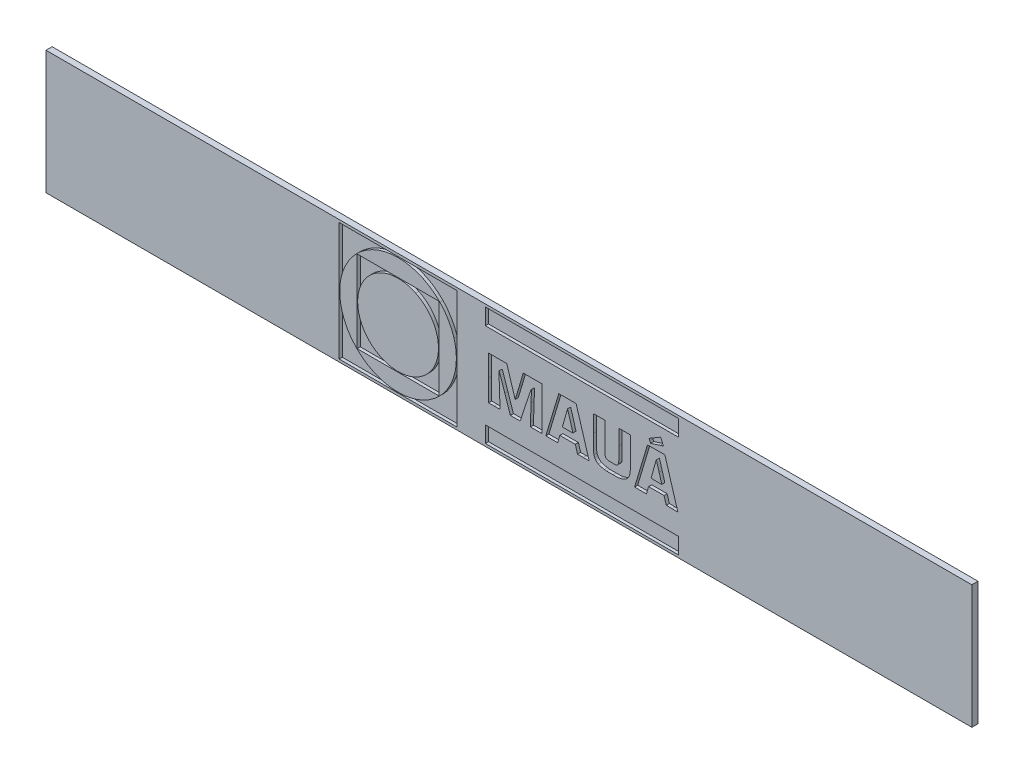
from build123d import *

# Parameters (mm, degrees)
SKETCH2_W           = 150
SKETCH2_H           = 20
BOSS_EXTRUDE1_DEPTH = 1
CUT_EXTRUDE2_DEPTH  = 0.5


with BuildPart() as part:
    # Sketch2 → Boss-Extrude1 (new body)
    with BuildSketch(Plane.XY):
        Rectangle(SKETCH2_W, SKETCH2_H)
    extrude(amount=-BOSS_EXTRUDE1_DEPTH)

    # Model → Cut-Extrude2 (cut)
    # profile 1 of 9: a face of its own
    with BuildSketch(Plane.XY):
        Polygon((-27.499542, 8.9e-05), (-27.499542, 9.575424), (-17.939724, 9.575424), (-8.379913, 9.575424), (-8.379913, 8.9e-05), (-8.379913, -9.575246), (-17.939724, -9.575246), (-27.499542, -9.575246), align=None)
        with BuildLine():
            add(Edge.make_bspline(
                [(-17.066178, -9.419263), (-15.21787, -9.236705), (-13.518165, -8.544789), (-12.053683, -7.37885)],
                knots=[0, 0, 0, 0, 1, 1, 1, 1], degree=3))
            add(Edge.make_bspline(
                [(-12.053683, -7.37885), (-11.634327, -7.044982), (-10.925684, -6.338994), (-10.598194, -5.928821)],
                knots=[0, 0, 0, 0, 1, 1, 1, 1], degree=3))
            add(Edge.make_bspline(
                [(-10.598194, -5.928821), (-8.649083, -3.487571), (-8.024915, -0.334739), (-8.896724, 2.665723)],
                knots=[0, 0, 0, 0, 1, 1, 1, 1], degree=3))
            add(Edge.make_bspline(
                [(-8.896724, 2.665723), (-9.302419, 4.061981), (-10.126115, 5.46327), (-11.183323, 6.555724)],
                knots=[0, 0, 0, 0, 1, 1, 1, 1], degree=3))
            add(Edge.make_bspline(
                [(-11.183323, 6.555724), (-12.735721, 8.159872), (-14.75563, 9.143306), (-17.008575, 9.391853)],
                knots=[0, 0, 0, 0, 1, 1, 1, 1], degree=3))
            add(Edge.make_bspline(
                [(-17.008575, 9.391853), (-17.487, 9.444634), (-18.526898, 9.435902), (-19.041588, 9.374815)],
                knots=[0, 0, 0, 0, 1, 1, 1, 1], degree=3))
            add(Edge.make_bspline(
                [(-19.041588, 9.374815), (-21.903657, 9.034957), (-24.437051, 7.425753), (-25.982041, 4.966257)],
                knots=[0, 0, 0, 0, 1, 1, 1, 1], degree=3))
            add(Edge.make_bspline(
                [(-25.982041, 4.966257), (-26.536223, 4.084045), (-26.963523, 3.046296), (-27.189766, 2.03313)],
                knots=[0, 0, 0, 0, 1, 1, 1, 1], degree=3))
            add(Edge.make_bspline(
                [(-27.189766, 2.03313), (-27.441569, 0.905518), (-27.474466, -0.450455), (-27.277869, -1.598358)],
                knots=[0, 0, 0, 0, 1, 1, 1, 1], degree=3))
            add(Edge.make_bspline(
                [(-27.277869, -1.598358), (-27.010868, -3.157349), (-26.350419, -4.628282), (-25.350524, -5.890896)],
                knots=[0, 0, 0, 0, 1, 1, 1, 1], degree=3))
            add(Edge.make_bspline(
                [(-25.350524, -5.890896), (-25.036828, -6.287019), (-24.257652, -7.068349), (-23.868054, -7.377473)],
                knots=[0, 0, 0, 0, 1, 1, 1, 1], degree=3))
            add(Edge.make_bspline(
                [(-23.868054, -7.377473), (-22.462892, -8.492383), (-20.802418, -9.194848), (-19.119187, -9.386483)],
                knots=[0, 0, 0, 0, 1, 1, 1, 1], degree=3))
            add(Edge.make_bspline(
                [(-19.119187, -9.386483), (-18.957006, -9.404964), (-18.782415, -9.424934), (-18.731202, -9.430909)],
                knots=[0, 0, 0, 0, 1, 1, 1, 1], degree=3))
            add(Edge.make_bspline(
                [(-18.731202, -9.430909), (-18.51204, -9.456459), (-17.361013, -9.448429), (-17.066178, -9.419263)],
                knots=[0, 0, 0, 0, 1, 1, 1, 1], degree=3))
        make_face(mode=Mode.SUBTRACT)
    # profile 2 of 9: a face of its own
    with BuildSketch(Plane.XY):
        Polygon((-24.581933, -0.015428), (-24.581933, 6.626778), (-17.955246, 6.626778), (-11.328556, 6.626778), (-11.328556, -0.015428), (-11.328556, -6.657639), (-17.955246, -6.657639), (-24.581933, -6.657639), align=None)
        with BuildLine():
            add(Edge.make_bspline(
                [(-17.314103, -6.532183), (-14.324241, -6.231309), (-11.884072, -3.887246), (-11.469903, -0.917792)],
                knots=[0, 0, 0, 0, 1, 1, 1, 1], degree=3))
            add(Edge.make_bspline(
                [(-11.469903, -0.917792), (-11.408064, -0.474448), (-11.407226, 0.449162), (-11.467878, 0.878586)],
                knots=[0, 0, 0, 0, 1, 1, 1, 1], degree=3))
            add(Edge.make_bspline(
                [(-11.467878, 0.878586), (-11.776606, 3.050471), (-13.125663, 4.904167), (-15.099326, 5.868433)],
                knots=[0, 0, 0, 0, 1, 1, 1, 1], degree=3))
            add(Edge.make_bspline(
                [(-15.099326, 5.868433), (-16.43455, 6.520774), (-17.917136, 6.697104), (-19.382618, 6.377867)],
                knots=[0, 0, 0, 0, 1, 1, 1, 1], degree=3))
            add(Edge.make_bspline(
                [(-19.382618, 6.377867), (-20.325978, 6.172369), (-21.378243, 5.655664), (-22.126394, 5.030567)],
                knots=[0, 0, 0, 0, 1, 1, 1, 1], degree=3))
            add(Edge.make_bspline(
                [(-22.126394, 5.030567), (-25.070257, 2.570896), (-25.320009, -1.791236), (-22.674552, -4.543472)],
                knots=[0, 0, 0, 0, 1, 1, 1, 1], degree=3))
            add(Edge.make_bspline(
                [(-22.674552, -4.543472), (-21.281862, -5.992374), (-19.29075, -6.731069), (-17.314103, -6.532183)],
                knots=[0, 0, 0, 0, 1, 1, 1, 1], degree=3))
        make_face(mode=Mode.SUBTRACT)
    # profile 3 of 9: a face of its own
    with BuildSketch(Plane.XY):
        Polygon((-3.817273, -8.271636), (-3.817273, -6.968026), (11.841581, -6.968026), (27.500432, -6.968026), (27.500432, -8.271636), (27.500432, -9.575246), (11.841581, -9.575246), (-3.817273, -9.575246), align=None)
    # profile 4 of 9: a face of its own
    with BuildSketch(Plane.XY):
        with BuildLine():
            Line((13.695633, 0.628616), (13.685557, 3.367751))
            Line((13.685557, 3.367751), (14.618119, 3.367751))
            Line((14.618119, 3.367751), (15.550683, 3.367751))
            Line((15.550683, 3.367751), (15.550683, 0.935874))
            add(Edge.make_bspline(
                [(15.550683, 0.935874), (15.550683, -0.818759), (15.560658, -1.525387), (15.586464, -1.601513)],
                knots=[0, 0, 0, 0, 1, 1, 1, 1], degree=3))
            add(Edge.make_bspline(
                [(15.586464, -1.601513), (15.644171, -1.771658), (15.727573, -1.86762), (15.884556, -1.9445)],
                knots=[0, 0, 0, 0, 1, 1, 1, 1], degree=3))
            add(Edge.make_bspline(
                [(15.884556, -1.9445), (16.019782, -2.010722), (16.080128, -2.017519), (16.625732, -2.027983)],
                knots=[0, 0, 0, 0, 1, 1, 1, 1], degree=3))
            add(Edge.make_bspline(
                [(16.625732, -2.027983), (17.10394, -2.037173), (17.253004, -2.030008), (17.390634, -1.989686)],
                knots=[0, 0, 0, 0, 1, 1, 1, 1], degree=3))
            add(Edge.make_bspline(
                [(17.390634, -1.989686), (17.588102, -1.932282), (17.732216, -1.791919), (17.783572, -1.606996)],
                knots=[0, 0, 0, 0, 1, 1, 1, 1], degree=3))
            add(Edge.make_bspline(
                [(17.783572, -1.606996), (17.805015, -1.529805), (17.8162, -0.660029), (17.816312, 0.939)],
                knots=[0, 0, 0, 0, 1, 1, 1, 1], degree=3))
            Line((17.816312, 0.939), (17.816411, 3.367751))
            Line((17.816411, 3.367751), (18.74756, 3.367751))
            Line((18.74756, 3.367751), (19.678709, 3.367751))
            Line((19.678709, 3.367751), (19.678709, 0.826671))
            add(Edge.make_bspline(
                [(19.678709, 0.826671), (19.678709, -1.294309), (19.671013, -1.75861), (19.632085, -1.981767)],
                knots=[0, 0, 0, 0, 1, 1, 1, 1], degree=3))
            add(Edge.make_bspline(
                [(19.632085, -1.981767), (19.474256, -2.886852), (19.014133, -3.344095), (18.048684, -3.555269)],
                knots=[0, 0, 0, 0, 1, 1, 1, 1], degree=3))
            add(Edge.make_bspline(
                [(18.048684, -3.555269), (17.776709, -3.614761), (17.626847, -3.624189), (16.823184, -3.632402)],
                knots=[0, 0, 0, 0, 1, 1, 1, 1], degree=3))
            add(Edge.make_bspline(
                [(16.823184, -3.632402), (16.319583, -3.637541), (15.872632, -3.636073), (15.829955, -3.628706)],
                knots=[0, 0, 0, 0, 1, 1, 1, 1], degree=3))
            add(Edge.make_bspline(
                [(15.829955, -3.628706), (15.787331, -3.621814), (15.626708, -3.600455), (15.473069, -3.581396)],
                knots=[0, 0, 0, 0, 1, 1, 1, 1], degree=3))
            add(Edge.make_bspline(
                [(15.473069, -3.581396), (15.128168, -3.53861), (14.738772, -3.428372), (14.491309, -3.303451)],
                knots=[0, 0, 0, 0, 1, 1, 1, 1], degree=3))
            add(Edge.make_bspline(
                [(14.491309, -3.303451), (14.120422, -3.116229), (13.91, -2.837476), (13.773881, -2.35305)],
                knots=[0, 0, 0, 0, 1, 1, 1, 1], degree=3))
            add(Edge.make_bspline(
                [(13.773881, -2.35305), (13.706436, -2.113028), (13.705623, -2.082151), (13.695633, 0.628616)],
                knots=[0, 0, 0, 0, 1, 1, 1, 1], degree=3))
        make_face()
    # profile 5 of 9: a face of its own
    with BuildSketch(Plane.XY):
        with BuildLine():
            Line((-3.289624, -0.124066), (-3.289624, 3.367751))
            Line((-3.289624, 3.367751), (-1.816764, 3.367751))
            Line((-1.816764, 3.367751), (-0.343909, 3.367751))
            Line((-0.343909, 3.367751), (-0.281235, 3.158245))
            add(Edge.make_bspline(
                [(-0.281235, 3.158245), (0.495493, 0.561812), (0.982289, -1.008657), (1.010378, -1.008657)],
                knots=[0, 0, 0, 0, 1, 1, 1, 1], degree=3))
            add(Edge.make_bspline(
                [(1.010378, -1.008657), (1.030252, -1.008657), (1.320797, -0.057069), (1.678494, 1.179547)],
                knots=[0, 0, 0, 0, 1, 1, 1, 1], degree=3))
            Line((1.678494, 1.179547), (2.311451, 3.367751))
            Line((2.311451, 3.367751), (3.82538, 3.367751))
            Line((3.82538, 3.367751), (5.339309, 3.367751))
            Line((5.339309, 3.367751), (5.331435, -0.116306))
            Line((5.331435, -0.116306), (5.323562, -3.600358))
            Line((5.323562, -3.600358), (4.397585, -3.608561))
            Line((4.397585, -3.608561), (3.471606, -3.616764))
            Line((3.471606, -3.616764), (3.495682, -2.848099))
            add(Edge.make_bspline(
                [(3.495682, -2.848099), (3.508948, -2.42533), (3.550303, -1.227429), (3.587603, -0.18609)],
                knots=[0, 0, 0, 0, 1, 1, 1, 1], degree=3))
            add(Edge.make_bspline(
                [(3.587603, -0.18609), (3.624895, 0.855246), (3.65246, 1.710738), (3.648852, 1.715009)],
                knots=[0, 0, 0, 0, 1, 1, 1, 1], degree=3))
            add(Edge.make_bspline(
                [(3.648852, 1.715009), (3.607143, 1.76435), (3.460626, 1.35287), (2.701159, -0.946529)],
                knots=[0, 0, 0, 0, 1, 1, 1, 1], degree=3))
            Line((2.701159, -0.946529), (1.819519, -3.615832))
            Line((1.819519, -3.615832), (1.026383, -3.615326))
            Line((1.026383, -3.615326), (0.23325, -3.614819))
            Line((0.23325, -3.614819), (-0.662845, -0.945853))
            add(Edge.make_bspline(
                [(-0.662845, -0.945853), (-1.155707, 0.522075), (-1.572113, 1.723108), (-1.588207, 1.723108)],
                knots=[0, 0, 0, 0, 1, 1, 1, 1], degree=3))
            add(Edge.make_bspline(
                [(-1.588207, 1.723108), (-1.619552, 1.723108), (-1.615334, 1.560543), (-1.501107, -1.644028)],
                knots=[0, 0, 0, 0, 1, 1, 1, 1], degree=3))
            add(Edge.make_bspline(
                [(-1.501107, -1.644028), (-1.462792, -2.71922), (-1.435161, -3.602644), (-1.439718, -3.607204)],
                knots=[0, 0, 0, 0, 1, 1, 1, 1], degree=3))
            add(Edge.make_bspline(
                [(-1.439718, -3.607204), (-1.44425, -3.611736), (-1.862357, -3.615483), (-2.368801, -3.615483)],
                knots=[0, 0, 0, 0, 1, 1, 1, 1], degree=3))
            Line((-2.368801, -3.615483), (-3.289608, -3.615483))
            Line((-3.289608, -3.615483), (-3.289624, -0.124066))
        make_face()
    # profile 6 of 9: a face of its own
    with BuildSketch(Plane.XY):
        with BuildLine():
            Line((9.487943, 3.367739), (10.884773, 3.367739))
            Line((10.884773, 3.367739), (11.94452, -0.114359))
            add(Edge.make_bspline(
                [(11.94452, -0.114359), (12.52738, -2.029512), (12.999889, -3.600832), (12.994542, -3.606179)],
                knots=[0, 0, 0, 0, 1, 1, 1, 1], degree=3))
            add(Edge.make_bspline(
                [(12.994542, -3.606179), (12.9892, -3.611546), (12.565477, -3.615875), (12.052937, -3.615875)],
                knots=[0, 0, 0, 0, 1, 1, 1, 1], degree=3))
            Line((12.052937, -3.615875), (11.121041, -3.615875))
            Line((11.121041, -3.615875), (10.938141, -3.010576))
            Line((10.938141, -3.010576), (10.755238, -2.405282))
            Line((10.755238, -2.405282), (9.501323, -2.41308))
            Line((9.501323, -2.41308), (8.247407, -2.420877))
            Line((8.247407, -2.420877), (8.076973, -3.018366))
            Line((8.076973, -3.018366), (7.906544, -3.615857))
            Line((7.906544, -3.615857), (6.944815, -3.615857))
            Line((6.944815, -3.615857), (5.98309, -3.615857))
            Line((5.98309, -3.615857), (6.001425, -3.530521))
            add(Edge.make_bspline(
                [(6.001425, -3.530521), (6.029544, -3.39961), (8.060601, 3.337242), (8.076844, 3.353485)],
                knots=[0, 0, 0, 0, 1, 1, 1, 1], degree=3))
            add(Edge.make_bspline(
                [(8.076844, 3.353485), (8.084692, 3.361308), (8.719686, 3.367739), (9.487943, 3.367739)],
                knots=[0, 0, 0, 0, 1, 1, 1, 1], degree=3))
        make_face()
        with BuildLine():
            add(Edge.make_bspline(
                [(10.367258, -1.016419), (10.367258, -0.930898), (9.511305, 1.962012), (9.494996, 1.931599)],
                knots=[0, 0, 0, 0, 1, 1, 1, 1], degree=3))
            add(Edge.make_bspline(
                [(9.494996, 1.931599), (9.475679, 1.895565), (8.66015, -0.992064), (8.66015, -1.02447)],
                knots=[0, 0, 0, 0, 1, 1, 1, 1], degree=3))
            add(Edge.make_bspline(
                [(8.66015, -1.02447), (8.66015, -1.032825), (9.04425, -1.03966), (9.513703, -1.03966)],
                knots=[0, 0, 0, 0, 1, 1, 1, 1], degree=3))
            add(Edge.make_bspline(
                [(9.513703, -1.03966), (9.983158, -1.03966), (10.367258, -1.029204), (10.367258, -1.016419)],
                knots=[0, 0, 0, 0, 1, 1, 1, 1], degree=3))
        make_face(mode=Mode.SUBTRACT)
    # profile 7 of 9: a face of its own
    with BuildSketch(Plane.XY):
        with BuildLine():
            Line((23.862704, 3.367751), (25.263536, 3.367751))
            Line((25.263536, 3.367751), (25.371641, 3.018569))
            add(Edge.make_bspline(
                [(25.371641, 3.018569), (25.908571, 1.284327), (27.379103, -3.592368), (27.368362, -3.60311)],
                knots=[0, 0, 0, 0, 1, 1, 1, 1], degree=3))
            add(Edge.make_bspline(
                [(27.368362, -3.60311), (27.3608, -3.61068), (26.9371, -3.61311), (26.426764, -3.608604)],
                knots=[0, 0, 0, 0, 1, 1, 1, 1], degree=3))
            Line((26.426764, -3.608604), (25.49888, -3.600351))
            Line((25.49888, -3.600351), (25.315002, -3.002862))
            Line((25.315002, -3.002862), (25.13113, -2.405378))
            Line((25.13113, -2.405378), (23.880584, -2.405378))
            Line((23.880584, -2.405378), (22.630041, -2.405378))
            Line((22.630041, -2.405378), (22.56854, -2.614886))
            add(Edge.make_bspline(
                [(22.56854, -2.614886), (22.534703, -2.730112), (22.457594, -2.997528), (22.397161, -3.209135)],
                knots=[0, 0, 0, 0, 1, 1, 1, 1], degree=3))
            add(Edge.make_bspline(
                [(22.397161, -3.209135), (22.336731, -3.420744), (22.282338, -3.598827), (22.276291, -3.604872)],
                knots=[0, 0, 0, 0, 1, 1, 1, 1], degree=3))
            add(Edge.make_bspline(
                [(22.276291, -3.604872), (22.259868, -3.621303), (20.36161, -3.618189), (20.36161, -3.601606)],
                knots=[0, 0, 0, 0, 1, 1, 1, 1], degree=3))
            add(Edge.make_bspline(
                [(20.36161, -3.601606), (20.36161, -3.573897), (22.437762, 3.343642), (22.449695, 3.355574)],
                knots=[0, 0, 0, 0, 1, 1, 1, 1], degree=3))
            add(Edge.make_bspline(
                [(22.449695, 3.355574), (22.456394, 3.362283), (23.092247, 3.367751), (23.862704, 3.367751)],
                knots=[0, 0, 0, 0, 1, 1, 1, 1], degree=3))
        make_face()
        with BuildLine():
            Line((23.893032, -1.039698), (24.761797, -1.039698))
            Line((24.761797, -1.039698), (24.33255, 0.453656))
            add(Edge.make_bspline(
                [(24.33255, 0.453656), (24.096464, 1.275002), (23.896867, 1.95345), (23.888997, 1.961318)],
                knots=[0, 0, 0, 0, 1, 1, 1, 1], degree=3))
            add(Edge.make_bspline(
                [(23.888997, 1.961318), (23.872389, 1.977926), (23.888592, 2.033495), (23.417145, 0.341509)],
                knots=[0, 0, 0, 0, 1, 1, 1, 1], degree=3))
            add(Edge.make_bspline(
                [(23.417145, 0.341509), (23.217373, -0.375476), (23.04725, -0.97956), (23.039093, -1.000897)],
                knots=[0, 0, 0, 0, 1, 1, 1, 1], degree=3))
            add(Edge.make_bspline(
                [(23.039093, -1.000897), (23.027438, -1.031364), (23.210803, -1.039698), (23.893032, -1.039698)],
                knots=[0, 0, 0, 0, 1, 1, 1, 1], degree=3))
        make_face(mode=Mode.SUBTRACT)
    # profile 8 of 9: a face of its own
    with BuildSketch(Plane.XY):
        with BuildLine():
            Line((22.821879, 4.112967), (22.694151, 4.392609))
            Line((22.694151, 4.392609), (23.211708, 4.698147))
            add(Edge.make_bspline(
                [(23.211708, 4.698147), (24.450553, 5.429484), (24.591193, 5.511202), (24.596524, 5.502777)],
                knots=[0, 0, 0, 0, 1, 1, 1, 1], degree=3))
            add(Edge.make_bspline(
                [(24.596524, 5.502777), (24.660294, 5.401949), (25.039661, 4.495717), (25.023959, 4.48173)],
                knots=[0, 0, 0, 0, 1, 1, 1, 1], degree=3))
            add(Edge.make_bspline(
                [(25.023959, 4.48173), (25.001597, 4.46183), (23.012299, 3.833328), (22.97161, 3.833328)],
                knots=[0, 0, 0, 0, 1, 1, 1, 1], degree=3))
            add(Edge.make_bspline(
                [(22.97161, 3.833328), (22.959511, 3.833328), (22.89213, 3.959166), (22.821879, 4.112967)],
                knots=[0, 0, 0, 0, 1, 1, 1, 1], degree=3))
        make_face()
    # profile 9 of 9: a face of its own
    with BuildSketch(Plane.XY):
        Polygon((-3.817273, 8.256294), (-3.817273, 9.575424), (11.841581, 9.575424), (27.500432, 9.575424), (27.500432, 8.256294), (27.500432, 6.937162), (11.841581, 6.937162), (-3.817273, 6.937162), align=None)
    extrude(amount=-CUT_EXTRUDE2_DEPTH, mode=Mode.SUBTRACT)


solid = part.part
